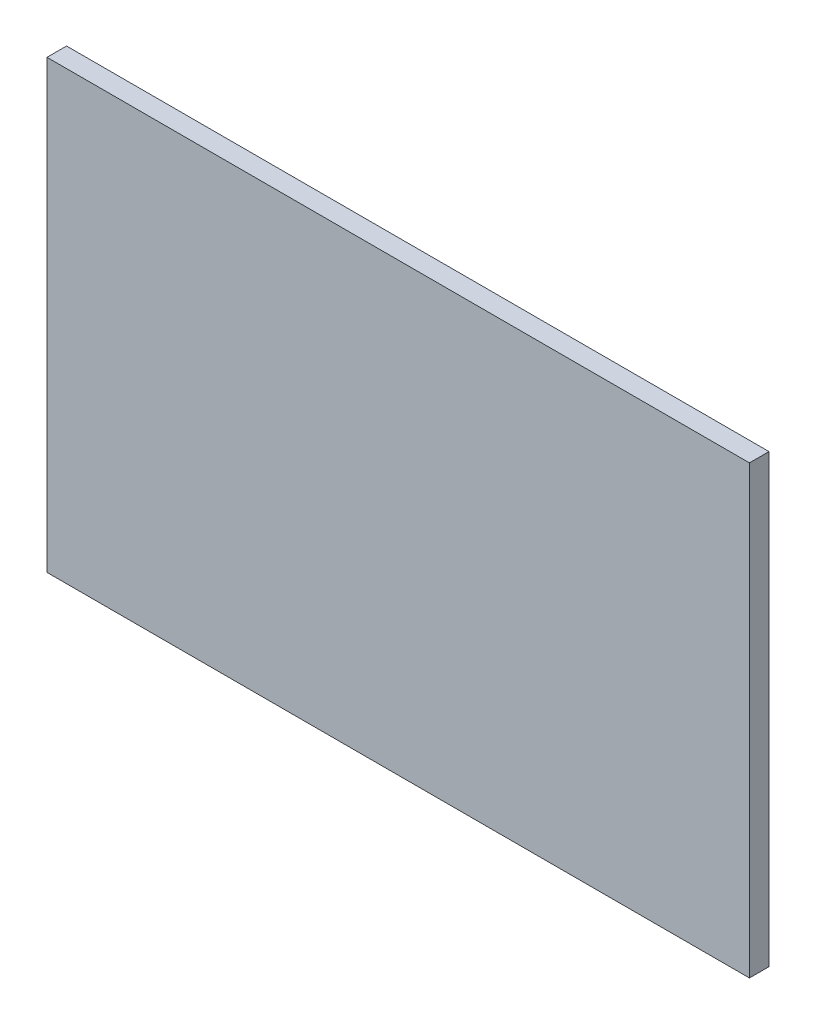
from build123d import *

# Parameters (mm, degrees)
SKETCH1_W           = 359
SKETCH1_H           = 228
BOSS_EXTRUDE1_DEPTH = 10


with BuildPart() as part:
    # Sketch1 → Boss-Extrude1 (new body)
    with BuildSketch(Plane.XY):
        Rectangle(SKETCH1_W, SKETCH1_H)
    extrude(amount=BOSS_EXTRUDE1_DEPTH)


solid = part.part
